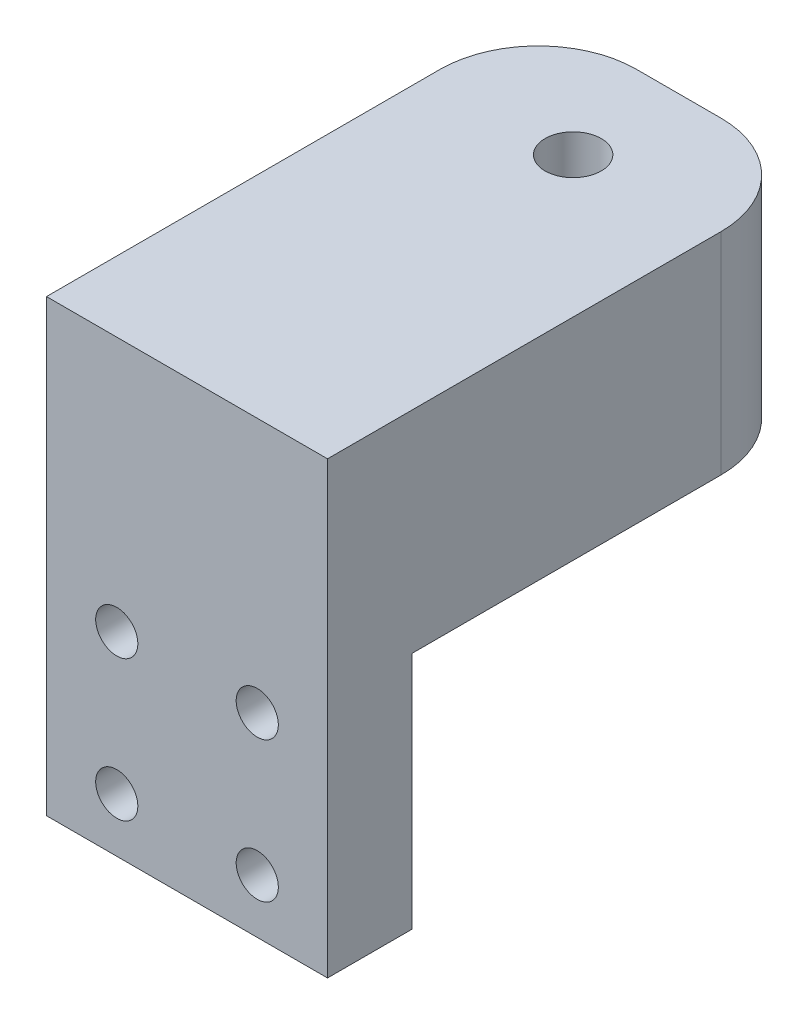
from build123d import *

# Parameters (mm, degrees)
SKETCH_1_W          = 20
SKETCH_1_H          = 20
SKETCH_1_R          = 1.5
EXTRUDE_1_DEPTH     = 6
SKETCH_2_W          = 20
SKETCH_2_H          = 3
EXTRUDE_2_DEPTH     = 29
SKETCH_3_W          = 20
SKETCH_3_H          = 35
EXTRUDE_3_DEPTH     = 12
CUT_EXTRUDE_1_DEPTH = 45.328320519


with BuildPart() as part:
    # Эскиз1 → Бобышка-Вытянуть1 (new body)
    with BuildSketch(Plane.XY):
        Rectangle(SKETCH_1_W, SKETCH_1_H)
        with Locations((-5, -6.152042824)):
            Circle(SKETCH_1_R, mode=Mode.SUBTRACT)
        with Locations((-5, 3.847957176)):
            Circle(SKETCH_1_R, mode=Mode.SUBTRACT)
        with Locations((5, 3.847957176)):
            Circle(SKETCH_1_R, mode=Mode.SUBTRACT)
        with Locations((5, -6.152042824)):
            Circle(SKETCH_1_R, mode=Mode.SUBTRACT)
    extrude(amount=EXTRUDE_1_DEPTH)

    # Эскиз2 → Бобышка-Вытянуть2 (add)
    with BuildSketch(Plane(origin=(0, 0, 0), x_dir=(-1, 0, 0), z_dir=(0, 0, -1))):
        with Locations((0, 8.5)):
            Rectangle(SKETCH_2_W, SKETCH_2_H)
    extrude(amount=EXTRUDE_2_DEPTH)

    # Эскиз3 → Бобышка-Вытянуть3 (add)
    with BuildSketch(Plane(origin=(0, 10, 0), x_dir=(1, 0, 0), z_dir=(0, 1, 0))):
        with Locations((0, 11.5)):
            Rectangle(SKETCH_3_W, SKETCH_3_H)
    extrude(amount=EXTRUDE_3_DEPTH)

    # Эскиз4 → Вырез-Вытянуть1 (cut, through all)
    with BuildSketch(Plane(origin=(0, 22, 0), x_dir=(1, 0, 0), z_dir=(0, 1, 0))):
        with BuildLine():
            Line((-10, 29), (-10, 22))
            ThreePointArc((-10, 22), (-7.949747468, 26.949747468), (-3, 29))
            Line((-3, 29), (-10, 29))
        make_face()
        with BuildLine():
            ThreePointArc((0, 23.482274908), (-2, 21.482274908), (0, 19.482274908))
            Line((0, 19.482274908), (0, 23.482274908))
        make_face()
        with BuildLine():
            Line((0, 23.482274908), (0, 19.482274908))
            ThreePointArc((0, 19.482274908), (1.414213562, 20.068061346), (2, 21.482274908))
            ThreePointArc((2, 21.482274908), (1.414213562, 22.89648847), (0, 23.482274908))
        make_face()
        with BuildLine():
            ThreePointArc((3, 29), (7.949747468, 26.949747468), (10, 22))
            Line((10, 22), (10, 29))
            Line((10, 29), (3, 29))
        make_face()
    extrude(amount=-CUT_EXTRUDE_1_DEPTH, mode=Mode.SUBTRACT)


solid = part.part
